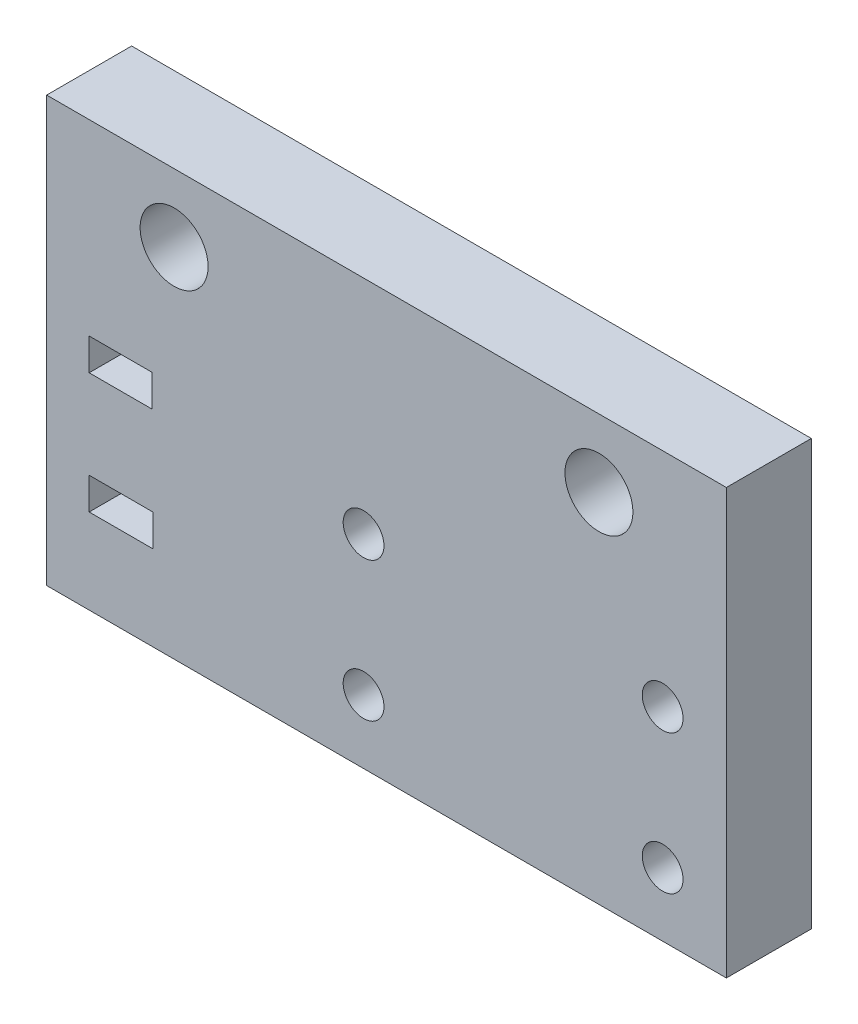
from build123d import *

# Parameters (mm, degrees)
SKETCH1_W           = 50.8
SKETCH1_H           = 57.15
BOSS_EXTRUDE1_DEPTH = 6.35
SKETCH5_R           = 1.524
SKETCH5_R_2         = 2.54
CUT_EXTRUDE1_DEPTH  = 72.447438113
SKETCH6_W           = 4.7625
SKETCH6_H           = 2.38125
SKETCH6_W_2         = 4.700923451
CUT_EXTRUDE2_DEPTH  = 72.447438113
SKETCH7_W           = 50.8
SKETCH7_H           = 25.4
CUT_EXTRUDE3_DEPTH  = 72.447438113


with BuildPart() as part:
    # Sketch1 → Boss-Extrude1 (new body)
    with BuildSketch(Plane.XY):
        with Locations((-32.446072824, -12.876728212)):
            Rectangle(SKETCH1_W, SKETCH1_H)
    extrude(amount=BOSS_EXTRUDE1_DEPTH)

    # Sketch5 → Cut-Extrude1 (cut, through all)
    with BuildSketch(Plane.XY.offset(6.35)):
        with Locations((-11.808572824, -26.275228212)):
            Circle(SKETCH5_R)
        with Locations((-11.808572824, -36.689228212)):
            Circle(SKETCH5_R)
        with Locations((-34.160572824, -26.275228212)):
            Circle(SKETCH5_R)
        with Locations((-34.160572824, -36.689228212)):
            Circle(SKETCH5_R)
        with Locations((-48.321072824, 10.618271788)):
            Circle(SKETCH5_R_2)
        with Locations((-16.571072824, 10.618271788)):
            Circle(SKETCH5_R_2)
        with Locations((-48.321072824, -2.081728212)):
            Circle(SKETCH5_R_2)
        with Locations((-16.571072824, -2.081728212)):
            Circle(SKETCH5_R_2)
        with Locations((-48.321072824, -14.781728212)):
            Circle(SKETCH5_R_2)
        with Locations((-16.571072824, -14.781728212)):
            Circle(SKETCH5_R_2)
    extrude(amount=-CUT_EXTRUDE1_DEPTH, mode=Mode.SUBTRACT)

    # Sketch6 → Cut-Extrude2 (cut, through all)
    with BuildSketch(Plane.XY.offset(6.35)):
        with Locations((-52.289822824, -33.911103212)):
            Rectangle(SKETCH6_W, SKETCH6_H)
        with Locations((-52.320611099, -24.900183987)):
            Rectangle(SKETCH6_W_2, SKETCH6_H)
    extrude(amount=-CUT_EXTRUDE2_DEPTH, mode=Mode.SUBTRACT)

    # Sketch7 → Cut-Extrude3 (cut, through all)
    with BuildSketch(Plane.XY.offset(6.35)):
        with Locations((-32.446072824, 2.998271788)):
            Rectangle(SKETCH7_W, SKETCH7_H)
    extrude(amount=-CUT_EXTRUDE3_DEPTH, mode=Mode.SUBTRACT)


solid = part.part
